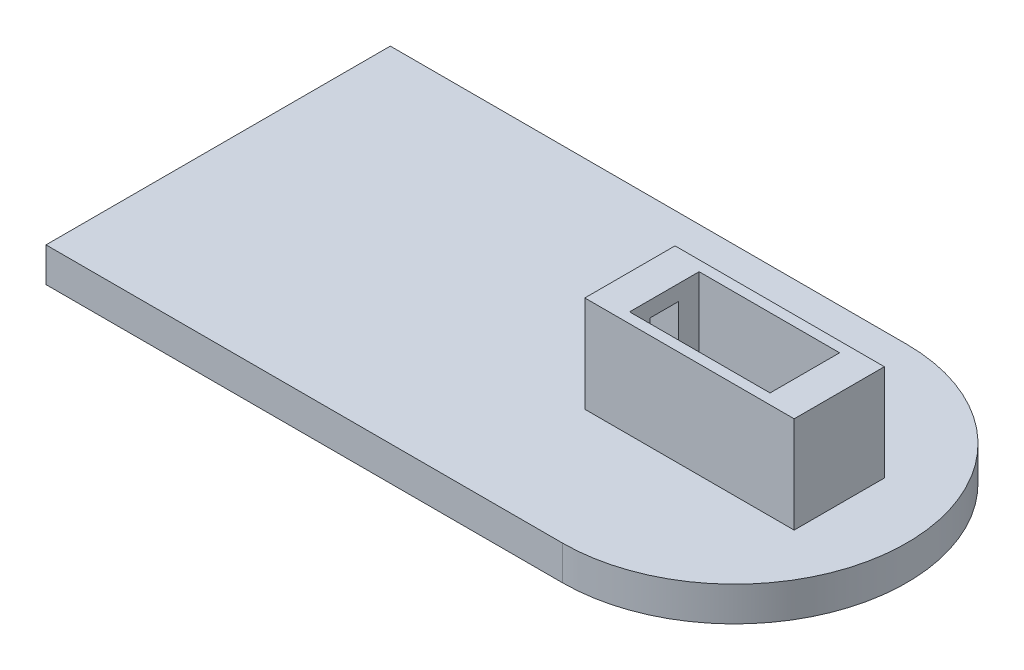
from build123d import *

# Parameters (mm, degrees)
BOSS_EXTRUDE4_DEPTH = 10
SKETCH6_W           = 46.8
SKETCH6_H           = 26.2
SKETCH6_W_2         = 40.8
SKETCH6_H_2         = 20.2
BOSS_EXTRUDE5_DEPTH = 28
SKETCH8_W           = 8.35
SKETCH8_H           = 20
CUT_EXTRUDE2_DEPTH  = 28
SKETCH12_W          = 26.2
SKETCH12_H          = 28
BOSS_EXTRUDE6_DEPTH = 7
SKETCH13_W          = 8.35
SKETCH13_H          = 4.5
SKETCH13_H_2        = 3.5
BOSS_EXTRUDE7_DEPTH = 7


with BuildPart() as part:
    # Sketch2 → Boss-Extrude4 (new body)
    with BuildSketch(Plane(origin=(0, 0, 0), x_dir=(1, 0, 0), z_dir=(0, 1, 0))):
        with BuildLine():
            Line((-74.999999302, 50.000000465), (75.000000698, 50.000000465))
            ThreePointArc((75.000000698, 50.000000465), (124.999999302, -9.31e-07), (74.999997905, -49.999999535))
            Line((74.999997905, -49.999999535), (-74.999999302, -49.999999535))
            Line((-74.999999302, -49.999999535), (-74.999999302, 50.000000465))
        make_face()
    extrude(amount=BOSS_EXTRUDE4_DEPTH)

    # Sketch6 → Boss-Extrude5 (add)
    with BuildSketch(Plane(origin=(0, 10, 0), x_dir=(1, 0, 0), z_dir=(0, 1, 0))):
        with Locations((74.999999302, 4.65e-07)):
            Rectangle(SKETCH6_W, SKETCH6_H)
        with Locations((74.999999302, 4.65e-07)):
            Rectangle(SKETCH6_W_2, SKETCH6_H_2, mode=Mode.SUBTRACT)
    extrude(amount=BOSS_EXTRUDE5_DEPTH)

    # Sketch8 → Cut-Extrude2 (cut)
    with BuildSketch(Plane.ZY.offset(-51.599999302)):
        with Locations((-4.65e-07, 23.5)):
            Rectangle(SKETCH8_W, SKETCH8_H)
    extrude(amount=-CUT_EXTRUDE2_DEPTH, mode=Mode.SUBTRACT)

    # Sketch12 → Boss-Extrude6 (add)
    with BuildSketch(Plane(origin=(98.399999302, 0, 0), x_dir=(0, 0, -1), z_dir=(1, 0, 0))):
        with Locations((4.65e-07, 24)):
            Rectangle(SKETCH12_W, SKETCH12_H)
    extrude(amount=BOSS_EXTRUDE6_DEPTH)

    # Sketch13 → Boss-Extrude7 (add)
    with BuildSketch(Plane.ZY.offset(-51.599999302)):
        Polygon((-4.175000465, 10), (-4.175000465, 13.5), (-4.175000465, 33.5), (-4.175000465, 38), (-13.100000465, 38), (-13.100000465, 10), align=None)
        with Locations((-4.65e-07, 35.75)):
            Rectangle(SKETCH13_W, SKETCH13_H)
        Polygon((4.174999535, 33.5), (4.174999535, 13.5), (4.174999535, 10), (13.099999535, 10), (13.099999535, 38), (4.174999535, 38), align=None)
        with Locations((-4.65e-07, 11.75)):
            Rectangle(SKETCH13_W, SKETCH13_H_2)
    extrude(amount=BOSS_EXTRUDE7_DEPTH)


solid = part.part
